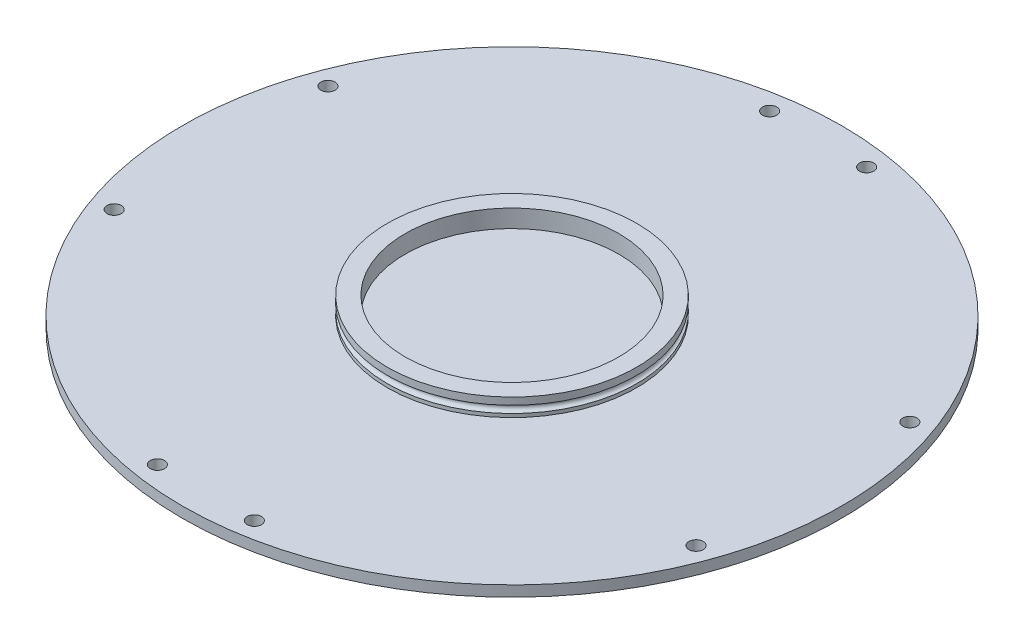
from build123d import *

# Parameters (mm, degrees)
SKETCH1_R           = 92.5
SKETCH1_R_2         = 2
BOSS_EXTRUDE1_DEPTH = 3
BOSS_EXTRUDE2_START = 3
SKETCH1_3_R         = 35
SKETCH1_3_R_2       = 30
BOSS_EXTRUDE2_DEPTH = 5


with BuildPart() as part:
    # Sketch1 → Boss-Extrude1 (new body)
    with BuildSketch(Plane(origin=(0, 0, 0), x_dir=(1, 0, 0), z_dir=(0, 1, 0))):
        Circle(SKETCH1_R)
        with Locations((-13.609798459, -85.928885632)):
            Circle(SKETCH1_R_2, mode=Mode.SUBTRACT)
        with Locations((-81.663945533, -30)):
            Circle(SKETCH1_R_2, mode=Mode.SUBTRACT)
        with Locations((13.609798459, -85.928885632)):
            Circle(SKETCH1_R_2, mode=Mode.SUBTRACT)
        with Locations((81.663945533, -30)):
            Circle(SKETCH1_R_2, mode=Mode.SUBTRACT)
        with Locations((-81.663945533, 30)):
            Circle(SKETCH1_R_2, mode=Mode.SUBTRACT)
        with Locations((-13.609798459, 85.928885632)):
            Circle(SKETCH1_R_2, mode=Mode.SUBTRACT)
        with Locations((81.663945533, 30)):
            Circle(SKETCH1_R_2, mode=Mode.SUBTRACT)
        with Locations((13.609798459, 85.928885632)):
            Circle(SKETCH1_R_2, mode=Mode.SUBTRACT)
    extrude(amount=BOSS_EXTRUDE1_DEPTH)

    # Sketch1<3> → Boss-Extrude2 (add)
    with BuildSketch(Plane(origin=(0, 0, 0), x_dir=(1, 0, 0), z_dir=(0, 1, 0)).offset(BOSS_EXTRUDE2_START)):
        Circle(SKETCH1_3_R)
        Circle(SKETCH1_3_R_2, mode=Mode.SUBTRACT)
    extrude(amount=BOSS_EXTRUDE2_DEPTH)

    # Sketch2 → Cut-Revolve1 (revolve, cut)
    with BuildSketch(Plane.XY):
        with BuildLine():
            Line((35, 6), (35, 4))
            ThreePointArc((35, 4), (34, 5), (35, 6))
        make_face()
    revolve(axis=Axis((0, 0, 0), (0, 1, 0)), mode=Mode.SUBTRACT)


solid = part.part
